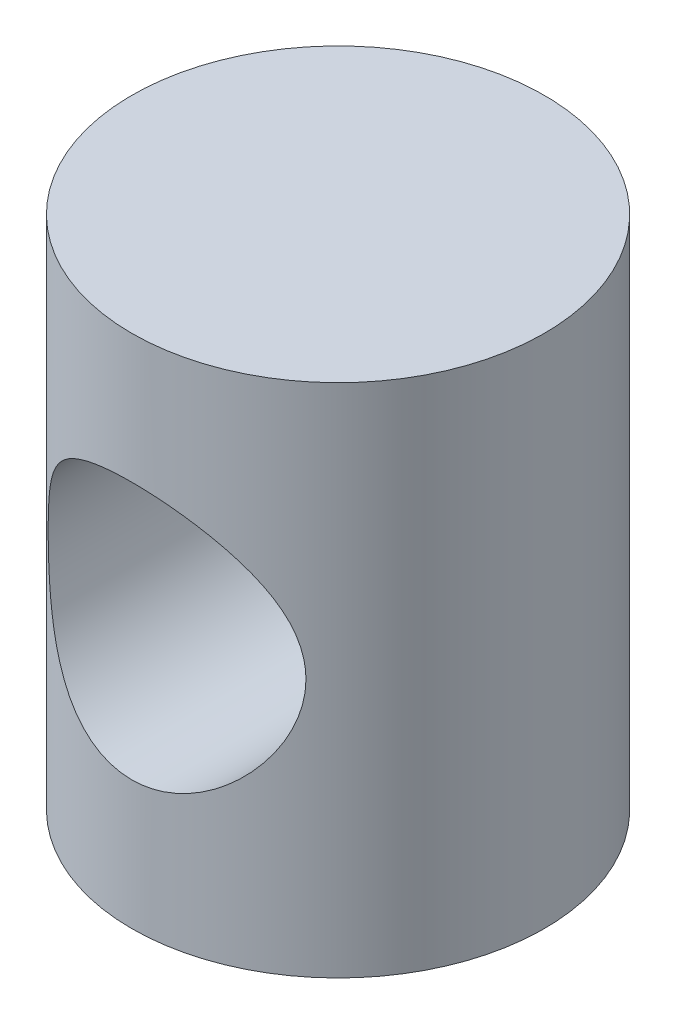
from build123d import *

# Parameters (mm, degrees)
SKETCH_1_R        = 4
EXTRUDE_1_DEPTH   = 10
HOLE_WIZARD_M61_D = 5


with BuildPart() as part:
    # Эскиз1 → Бобышка-Вытянуть1 (new body)
    with BuildSketch(Plane(origin=(0, 0, 0), x_dir=(1, 0, 0), z_dir=(0, 1, 0))):
        with Locations(Location((0, 0, 0), (0, 0, 270))):
            Circle(SKETCH_1_R)
    extrude(amount=EXTRUDE_1_DEPTH)

    # Отверстие обработанное метчиком M61 (through all)
    with Locations(Plane(origin=(0, 5, 4), x_dir=(1, 0, 0), z_dir=(0, 0, 1))):
        with Locations((0, 0)):
            Hole(HOLE_WIZARD_M61_D / 2)


solid = part.part
